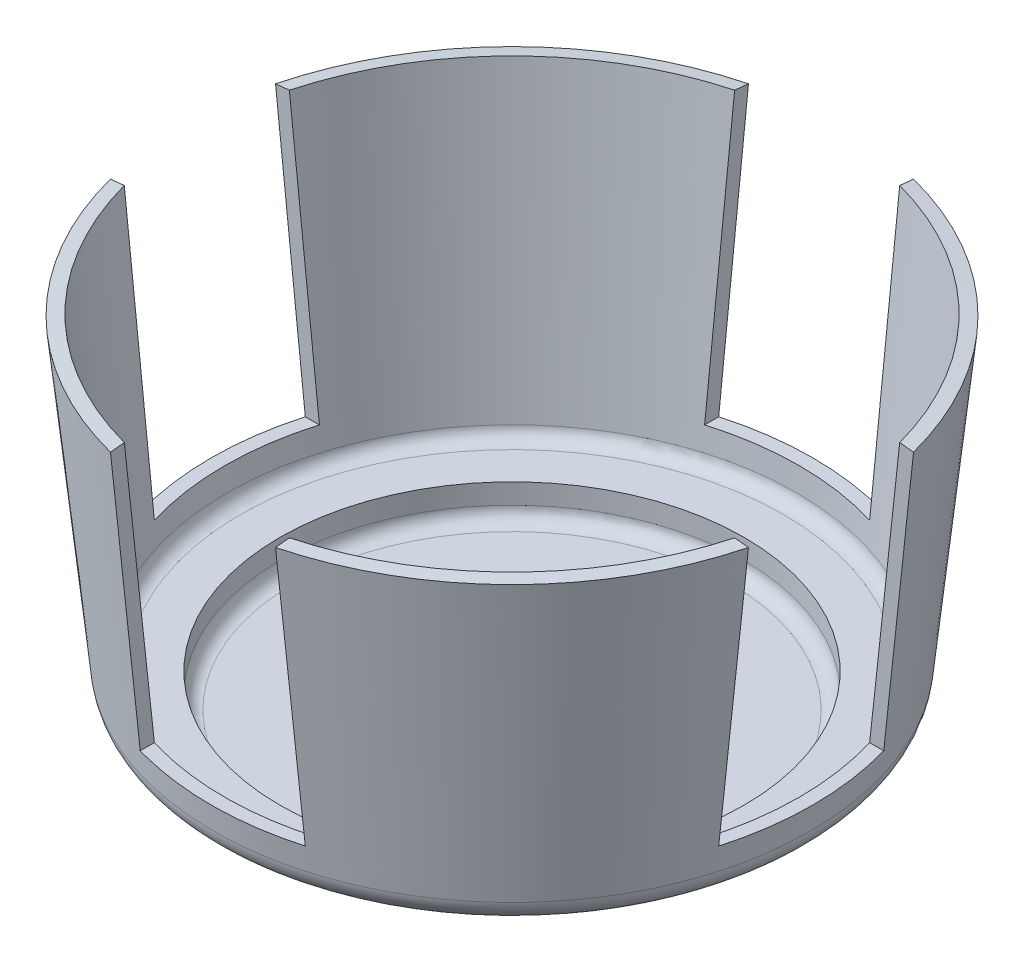
from build123d import *

# Parameters (mm, degrees)
CUT_EXTRUDE1_REACH = 88.028
SKETCH2_W          = 24.54
SKETCH2_H          = 40.87
CIRPATTERN1_COUNT  = 4
CUT_EXTRUDE2_REACH = 87.485
SKETCH3_R          = 21


with BuildPart() as part:
    # Sketch1 → Revolve-Thin1 (revolve)
    with BuildSketch(Plane.XY, mode=Mode.PRIVATE) as revolve_thin1_sk:
        with BuildLine():
            Line((0, 0), (32.5, 0))
            ThreePointArc((32.5, 0), (33.914213562, 0.585786438), (34.5, 2))
            Line((34.5, 2), (34.5, 5))
            Line((34.5, 5), (40.364397089, 5))
            ThreePointArc((40.364397089, 5), (41.702658302, 5.513710349), (42.35344088, 6.790943073))
            Line((42.35344088, 6.790943073), (47, 51))
            Line((47, 51), (48.989043791, 50.790943073))
            Line((48.989043791, 50.790943073), (44.342484671, 6.581886147))
            ThreePointArc((44.342484671, 6.581886147), (43.040919515, 4.027420698), (40.364397089, 3))
            Line((40.364397089, 3), (36.5, 3))
            Line((36.5, 3), (36.5, 2))
            ThreePointArc((36.5, 2), (35.328427125, -0.828427125), (32.5, -2))
            Line((32.5, -2), (0, -2))
            Line((0, -2), (0, 0))
        make_face()
    revolve(revolve_thin1_sk.sketch.rotate(Axis((0, 0, 0), (0, 1, 0)), 90), axis=Axis((0, 0, 0), (0, 1, 0)))

    # Sketch2 → Cut-Extrude1 (cut, up to next)
    with BuildSketch(Plane.XY, mode=Mode.PRIVATE) as cut_extrude1_sk1:
        with Locations((0, 30.565)):
            Rectangle(SKETCH2_W, SKETCH2_H)
    cut_extrude1_tool1 = extrude(cut_extrude1_sk1.sketch, amount=CUT_EXTRUDE1_REACH, mode=Mode.PRIVATE) & part.part
    cut_extrude1 = cut_extrude1_tool1.solids().sort_by_distance((0, 30.565, 0))[0]
    add(cut_extrude1, mode=Mode.SUBTRACT)

    # CirPattern1: Cut-Extrude1 ×4 about axis
    cirpattern1_axis = Axis((0, 0, 0), (0, 1, 0))
    for i in range(1, CIRPATTERN1_COUNT):
        add(cut_extrude1.rotate(cirpattern1_axis, i * 360 / CIRPATTERN1_COUNT), mode=Mode.SUBTRACT)

    # Sketch3 → Cut-Extrude2 (cut, up to next)
    with BuildSketch(Plane.XZ.offset(2), mode=Mode.PRIVATE) as cut_extrude2_sk1:
        with Locations(Location((0, 0, 0), (0, 0, 270))):
            Circle(SKETCH3_R)
    cut_extrude2_tool1 = extrude(cut_extrude2_sk1.sketch, amount=-CUT_EXTRUDE2_REACH, mode=Mode.PRIVATE) & part.part
    add(cut_extrude2_tool1.solids().sort_by_distance((0, -2, 0))[0], mode=Mode.SUBTRACT)


solid = part.part
